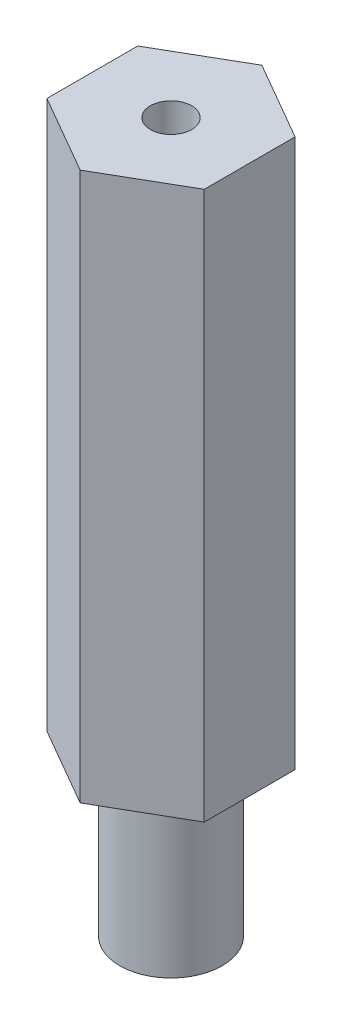
from build123d import *

# Parameters (mm, degrees)
BOSS_EXTRUDE1_DEPTH = 15.748
SKETCH2_R           = 1.4732
BOSS_EXTRUDE2_DEPTH = 4.6228
SKETCH3_R           = 0.593671867
CUT_EXTRUDE1_DEPTH  = 2.54


with BuildPart() as part:
    # Sketch1 → Boss-Extrude1 (new body)
    with BuildSketch(Plane(origin=(0, 0, 0), x_dir=(1, 0, 0), z_dir=(0, 1, 0))):
        Polygon((2.2606, 1.305158019), (0, 2.610316037), (-2.2606, 1.305158019), (-2.2606, -1.305158019), (0, -2.610316037), (2.2606, -1.305158019), align=None)
    extrude(amount=BOSS_EXTRUDE1_DEPTH)

    # Sketch2 → Boss-Extrude2 (add)
    with BuildSketch(Plane.XZ):
        with Locations(Location((0, 0, 0), (0, 0, 90))):
            Circle(SKETCH2_R)
    extrude(amount=BOSS_EXTRUDE2_DEPTH)

    # Sketch3 → Cut-Extrude1 (cut)
    with BuildSketch(Plane(origin=(0, 15.748, 0), x_dir=(1, 0, 0), z_dir=(0, 1, 0))):
        with Locations(Location((0, 0, 0), (0, 0, 270))):
            Circle(SKETCH3_R)
    extrude(amount=-CUT_EXTRUDE1_DEPTH, mode=Mode.SUBTRACT)


solid = part.part
